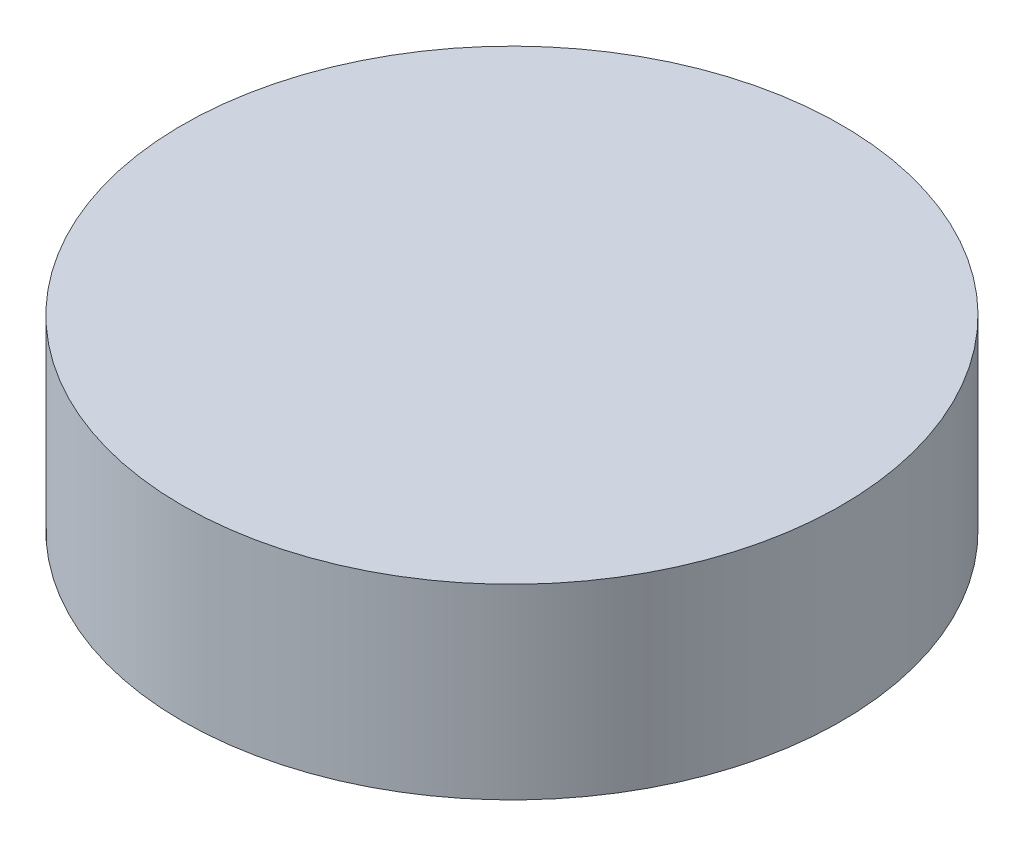
from build123d import *

# Parameters (mm, degrees)
SKETCH1_R           = 15
BOSS_EXTRUDE1_DEPTH = 8.5


with BuildPart() as part:
    # Sketch1 → Boss-Extrude1 (new body)
    with BuildSketch(Plane(origin=(0, 0, 0), x_dir=(1, 0, 0), z_dir=(0, 1, 0))):
        with Locations(Location((0, 0, 0), (0, 0, 270))):
            Circle(SKETCH1_R)
    extrude(amount=BOSS_EXTRUDE1_DEPTH)


solid = part.part
